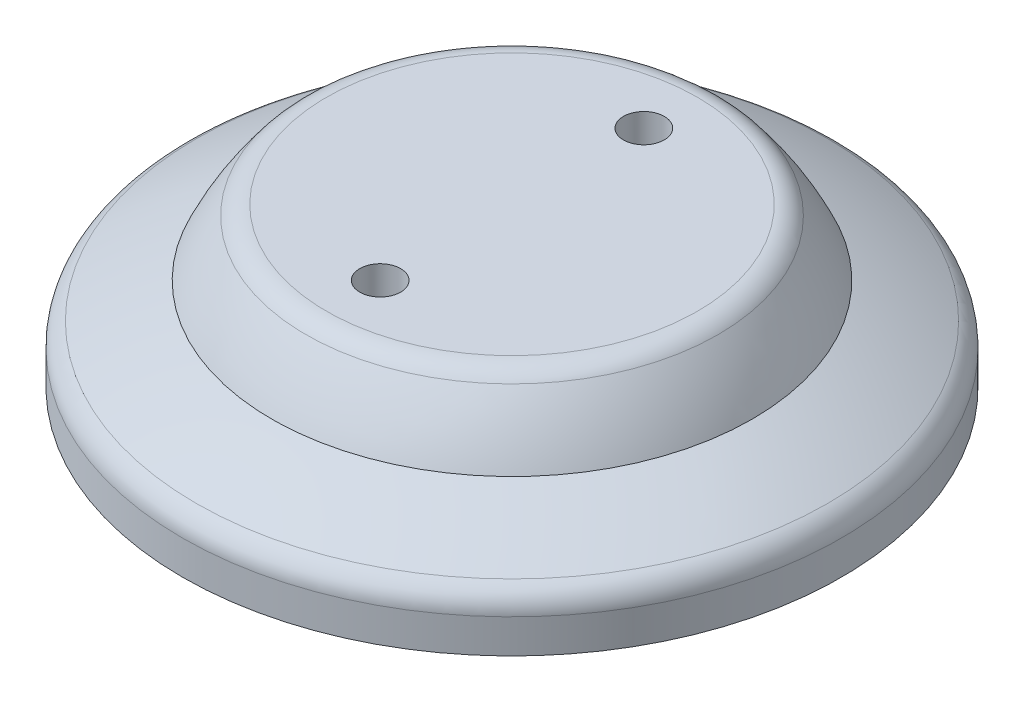
from build123d import *

# Parameters (mm, degrees)
CROQUIS6_R              = 23.5
CORTAR_EXTRUIR2_DEPTH   = 0.5
CROQUIS7_R              = 3.05
CROQUIS7_R_2            = 1.55
SALIENTE_EXTRUIR1_DEPTH = 9.5
CORTAR_EXTRUIR3_START   = -5.5
CROQUIS8_R              = 1.55
CORTAR_EXTRUIR3_DEPTH   = 5.5
REDONDEO1_R             = 2
REDONDEO2_R             = 2
CROQUIS9_R              = 23.5
CORTAR_EXTRUIR4_DEPTH   = 1


with BuildPart() as part:
    # Croquis3 → Revolución1 (revolve)
    with BuildSketch(Plane.XY):
        with BuildLine():
            Line((25, 0), (25, 3.742571384))
            ThreePointArc((25, 3.742571384), (21.675655898, 5.498663982), (18.228756555, 7))
            ThreePointArc((18.228756555, 7), (16.801415582, 9.620779584), (15, 12))
            Line((15, 12), (0, 12))
            Line((0, 12), (0, 0))
            Line((0, 0), (25, 0))
        make_face()
    revolve(axis=Axis((0, 0, 0), (0, 1, 0)))

    # Croquis4 → Cortar-Revolución1 (revolve, cut)
    with BuildSketch(Plane.XY):
        with BuildLine():
            Line((0, 1.5), (0, 10.5))
            Line((0, 10.5), (14.30686093, 10.5))
            ThreePointArc((14.30686093, 10.5), (15.877398251, 8.266411941), (17.102065618, 5.825983099))
            ThreePointArc((17.102065618, 5.825983099), (20.35484662, 4.463230038), (23.5, 2.867708066))
            Line((23.5, 2.867708066), (23.5, 1.5))
            Line((23.5, 1.5), (0, 1.5))
        make_face()
    revolve(axis=Axis((0, 10.5, 0), (0, 1, 0)), mode=Mode.SUBTRACT)

    # Croquis6 → Cortar-Extruir2 (cut)
    with BuildSketch(Plane.XZ):
        with Locations(Location((0, 0, 0), (0, 0, 270))):
            Circle(CROQUIS6_R)
    extrude(amount=-CORTAR_EXTRUIR2_DEPTH, mode=Mode.SUBTRACT)

    # Croquis7 → Saliente-Extruir1 (add)
    # profile 1 of 2: a face of its own
    with BuildSketch(Plane.XZ.offset(-10.5)):
        with Locations(Location((0, 10, 0), (0, 0, 180))):
            Circle(CROQUIS7_R)
        with Locations((0, 10)):
            Circle(CROQUIS7_R_2, mode=Mode.SUBTRACT)
    # profile 2 of 2: a face of its own
    with BuildSketch(Plane.XZ.offset(-10.5)):
        with Locations(Location((0, -10, 0), (0, 0, 180))):
            Circle(CROQUIS7_R)
        with Locations(Location((0, -10, 0), (0, 0, 90))):
            Circle(CROQUIS7_R_2, mode=Mode.SUBTRACT)
    extrude(amount=SALIENTE_EXTRUIR1_DEPTH)

    # Croquis8 → Cortar-Extruir3 (cut)
    with BuildSketch(Plane.XZ.offset(-10.5).offset(CORTAR_EXTRUIR3_START)):
        with Locations((0, -10)):
            Circle(CROQUIS8_R)
        with Locations((0, 10)):
            Circle(CROQUIS8_R)
    extrude(amount=CORTAR_EXTRUIR3_DEPTH, mode=Mode.SUBTRACT)

    # Redondeo1
    redondeo1_edges = [part.edges().sort_by_distance(p)[0] for p in [
        (-15, 12, 0),
    ]]
    fillet(redondeo1_edges, radius=REDONDEO1_R)

    # Redondeo2
    redondeo2_edges = [part.edges().sort_by_distance(p)[0] for p in [
        (-25, 3.742571384, 0),
    ]]
    fillet(redondeo2_edges, radius=REDONDEO2_R)

    # Croquis9 → Cortar-Extruir4 (cut)
    with BuildSketch(Plane.XZ.offset(-0.5)):
        Circle(CROQUIS9_R)
    extrude(amount=-CORTAR_EXTRUIR4_DEPTH, mode=Mode.SUBTRACT)


solid = part.part
